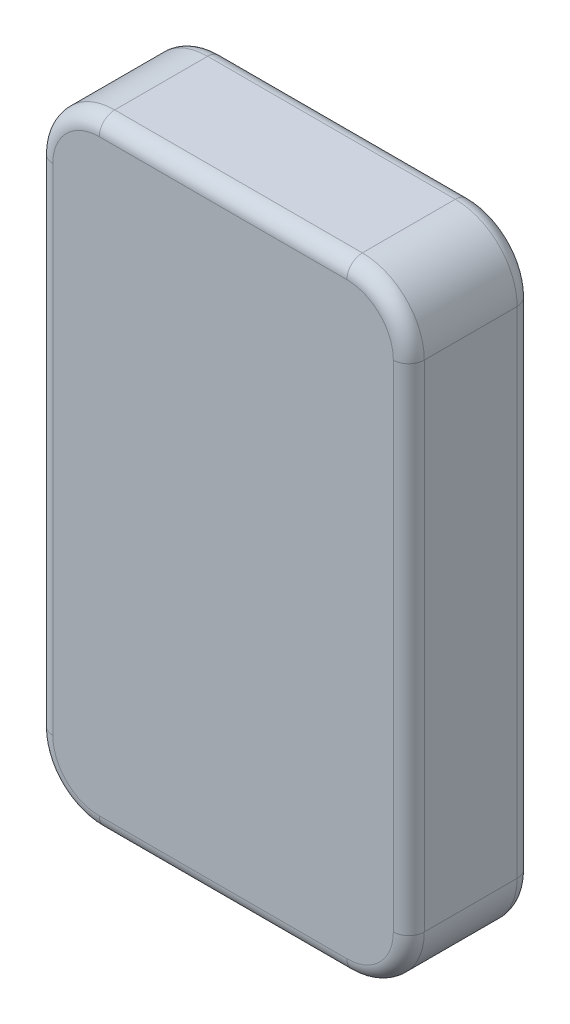
from build123d import *

# Parameters (mm, degrees)
SKETCH1_W           = 24
SKETCH1_H           = 40
BOSS_EXTRUDE1_DEPTH = 8
FILLET1_R           = 4
FILLET2_R           = 1


with BuildPart() as part:
    # Sketch1 → Boss-Extrude1 (new body)
    with BuildSketch(Plane.XY):
        with Locations((-35.448560737, 342.247885871)):
            Rectangle(SKETCH1_W, SKETCH1_H)
    extrude(amount=-BOSS_EXTRUDE1_DEPTH)

    # Fillet1
    fillet1_edges = [part.edges().sort_by_distance(p)[0] for p in [
        (-47.448560737, 362.247885871, -4),
        (-23.448560737, 362.247885871, -4),
        (-23.448560737, 322.247885871, -4),
        (-47.448560737, 322.247885871, -4),
    ]]
    fillet(fillet1_edges, radius=FILLET1_R)

    # Fillet2
    fillet2_edges = [part.edges().sort_by_distance(p)[0] for p in [
        (-23.448560737, 342.247885871, 0),
        (-23.448560737, 342.247885871, -8),
        (-47.448560737, 342.247885871, 0),
        (-35.448560737, 322.247885871, 0),
        (-35.448560737, 362.247885871, 0),
        (-46.276987862, 361.076312996, 0),
        (-46.276987862, 323.419458746, 0),
        (-24.620133612, 323.419458746, 0),
        (-24.620133612, 361.076312996, 0),
        (-35.448560737, 362.247885871, -8),
        (-47.448560737, 342.247885871, -8),
        (-35.448560737, 322.247885871, -8),
        (-46.276987862, 361.076312996, -8),
        (-46.276987862, 323.419458746, -8),
        (-24.620133612, 323.419458746, -8),
        (-24.620133612, 361.076312996, -8),
    ]]
    fillet(fillet2_edges, radius=FILLET2_R)


solid = part.part
